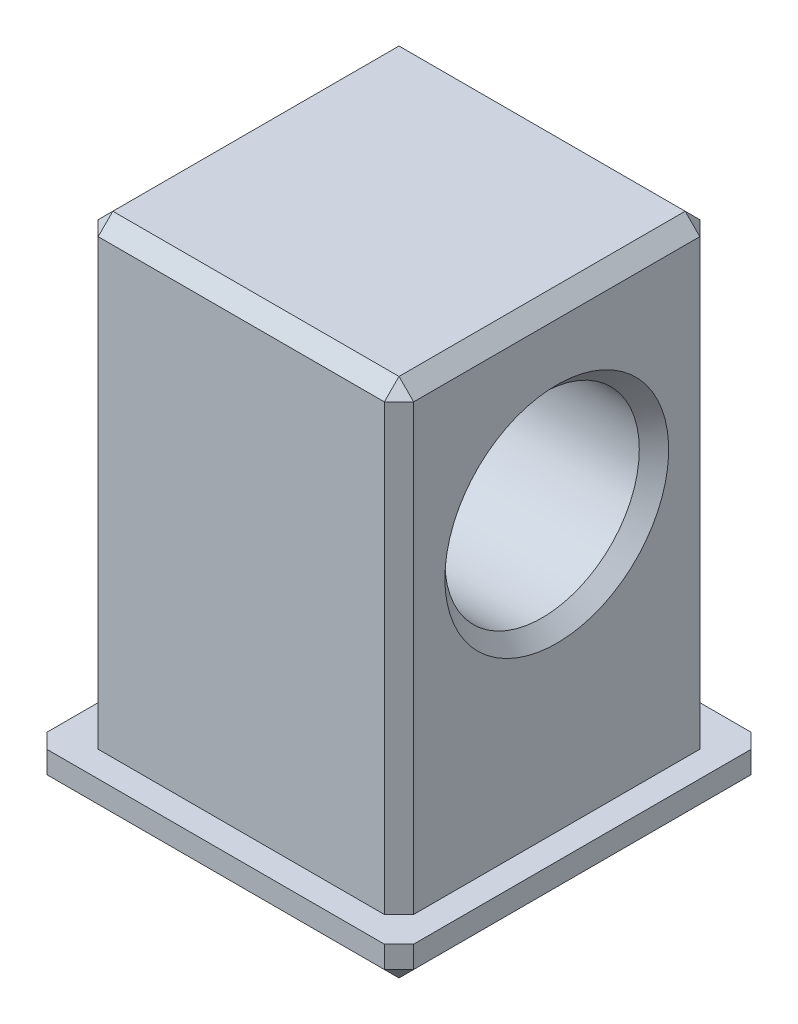
from build123d import *

# Parameters (mm, degrees)
SKETCH1_W           = 25.4
SKETCH1_H           = 25.4
BOSS_EXTRUDE1_DEPTH = 2.54
SKETCH2_W           = 21.844
SKETCH2_H           = 21.844
BOSS_EXTRUDE2_DEPTH = 31.75
SKETCH3_R           = 6.731
CUT_EXTRUDE1_DEPTH  = 49.774614135
CHAMFER1_SIZE       = 1.016


with BuildPart() as part:
    # Sketch1 → Boss-Extrude1 (new body)
    with BuildSketch(Plane(origin=(0, 0, 0), x_dir=(1, 0, 0), z_dir=(0, 1, 0))):
        with Locations((12.7, 12.7)):
            Rectangle(SKETCH1_W, SKETCH1_H)
    extrude(amount=BOSS_EXTRUDE1_DEPTH)

    # Sketch2 → Boss-Extrude2 (add)
    with BuildSketch(Plane(origin=(0, 2.54, 0), x_dir=(1, 0, 0), z_dir=(0, 1, 0))):
        with Locations((12.7, 12.7)):
            Rectangle(SKETCH2_W, SKETCH2_H)
    extrude(amount=BOSS_EXTRUDE2_DEPTH)

    # Sketch3 → Cut-Extrude1 (cut, through all)
    with BuildSketch(Plane.ZY.offset(-1.778)):
        with Locations((-12.7, 21.59)):
            Circle(SKETCH3_R)
    extrude(amount=-CUT_EXTRUDE1_DEPTH, mode=Mode.SUBTRACT)

    # Chamfer1
    chamfer1_edges = [part.edges().sort_by_distance(p)[0] for p in [
        (1.778, 18.415, -23.622),
        (1.778, 18.415, -1.778),
        (23.622, 18.415, -1.778),
        (23.622, 18.415, -23.622),
        (1.778, 34.29, -12.7),
        (12.7, 34.29, -1.778),
        (23.622, 34.29, -12.7),
        (12.7, 34.29, -23.622),
        (23.622, 21.59, -19.431),
        (1.778, 21.59, -19.431),
        (12.7, 0, -25.4),
        (25.4, 0, -12.7),
        (12.7, 0, 0),
        (0, 0, -12.7),
        (0, 1.27, -25.4),
        (25.4, 1.27, -25.4),
        (25.4, 1.27, 0),
        (0, 1.27, 0),
    ]]
    chamfer(chamfer1_edges, length=CHAMFER1_SIZE)


solid = part.part
